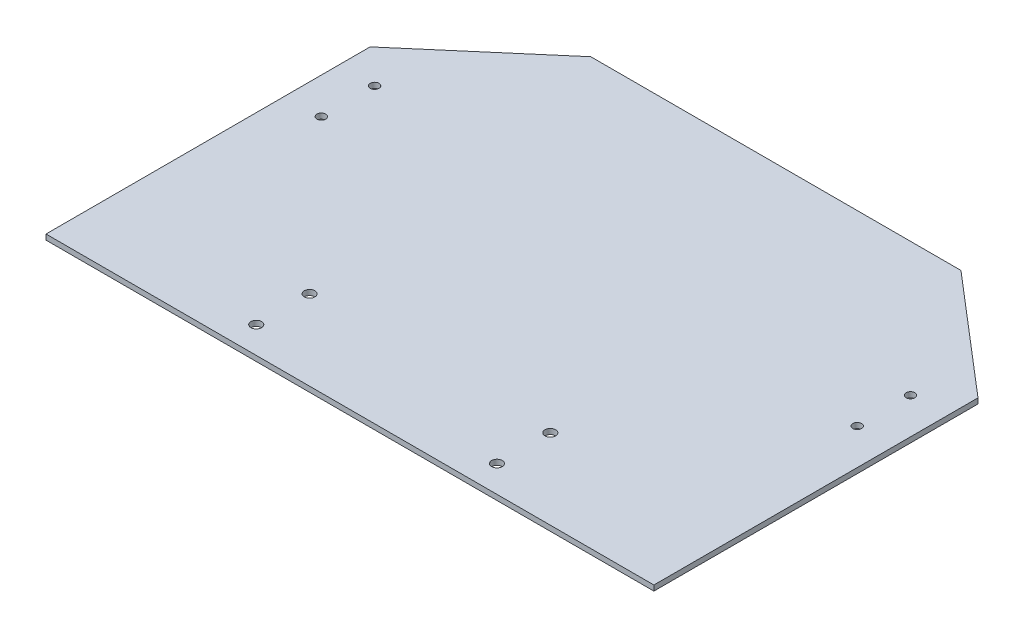
from build123d import *

# Parameters (mm, degrees)
RESSALTO_EXTRUS_O1_DEPTH = 2
ESBO_O3_R                = 2
CORTE_EXTRUS_O2_DEPTH    = 10
ESBO_O5_R                = 1.65
CORTE_EXTRUS_O5_DEPTH    = 2


with BuildPart() as part:
    # Esboço1 → Ressalto-extrusão1 (new body)
    with BuildSketch(Plane(origin=(0, 0, 0), x_dir=(1, 0, 0), z_dir=(0, 1, 0))):
        Polygon((-114, 41.685), (-114, -79.875), (-51, -79.875), (0, -79.875), (0, 79.875), (-69.415, 79.875), align=None)
        Polygon((0, 79.875), (0, -79.875), (51.996049983, -79.875), (114, -79.875), (114, 41.685), (69.415, 79.875), align=None)
    extrude(amount=RESSALTO_EXTRUS_O1_DEPTH)

    # Esboço3 → Corte-extrusão2 (cut)
    with BuildSketch(Plane(origin=(0, 2, 0), x_dir=(1, 0, 0), z_dir=(0, 1, 0))):
        with Locations(Location((-45.14, -69.875, 0), (0, 0, 270))):
            Circle(ESBO_O3_R)
        with Locations(Location((45.14, -69.875, 0), (0, 0, 270))):
            Circle(ESBO_O3_R)
        with Locations(Location((-45.14, -49.875, 0), (0, 0, 270))):
            Circle(ESBO_O3_R)
        with Locations(Location((45.14, -49.875, 0), (0, 0, 270))):
            Circle(ESBO_O3_R)
    extrude(amount=-CORTE_EXTRUS_O2_DEPTH, mode=Mode.SUBTRACT)

    # Esboço5 → Corte-extrusão5 (cut)
    with BuildSketch(Plane(origin=(0, 2, 0), x_dir=(1, 0, 0), z_dir=(0, 1, 0))):
        with Locations(Location((100.5, 29.876998266, 0), (0, 0, 270))):
            Circle(ESBO_O5_R)
        with Locations(Location((100.5, 9.876998266, 0), (0, 0, 270))):
            Circle(ESBO_O5_R)
        with Locations(Location((-100.5, 29.876998266, 0), (0, 0, 270))):
            Circle(ESBO_O5_R)
        with Locations(Location((-100.5, 9.876998266, 0), (0, 0, 270))):
            Circle(ESBO_O5_R)
    extrude(amount=-CORTE_EXTRUS_O5_DEPTH, mode=Mode.SUBTRACT)


solid = part.part
